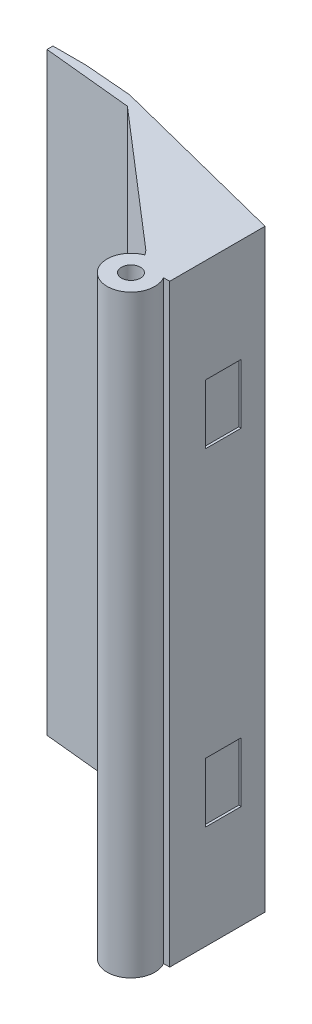
from build123d import *

# Parameters (mm, degrees)
ONE_PIECE_PROGRESSIVE_SOLID_WEDGE_DEPTH      = 99.7
ONE_PIECE_PROGRESSIVE_SOLID_WEDGE_DEPTH_BACK = 99.7
INTEGRAL_FULL_WIDTH_PIVOT_BOSS_DEPTH         = 99.7
INTEGRAL_FULL_WIDTH_PIVOT_BOSS_DEPTH_BACK    = 99.7
SKETCH_2_R                                   = 8
M6_MANUAL_PIVOT_DEPTH                        = 110
M6_MANUAL_PIVOT_DEPTH_BACK                   = 110
SKETCH_3_R                                   = 3.2
RECESSED_HOOK_PATCH_65_START                 = -45
SKETCH_4_W                                   = 0.81
SKETCH_4_H                                   = 12
RECESSED_HOOK_PATCH_65_DEPTH                 = 20
RECESSED_HOOK_PATCH_45_START                 = 65
SKETCH_5_W                                   = 0.81
SKETCH_5_H                                   = 12
RECESSED_HOOK_PATCH_45_DEPTH                 = 20


with BuildPart() as part:
    # 草图1 → One_piece_progressive_solid_wedge (new, two sides: drawn at the far end of the back side and taken through both)
    with BuildSketch(Plane(origin=(0, 0, 0), x_dir=(1, 0, 0), z_dir=(0, 1, 0)).offset(-ONE_PIECE_PROGRESSIVE_SOLID_WEDGE_DEPTH_BACK)):
        Polygon((-198, -1.2), (-198, -3.2), (-168, -6.2), (-123, -45), (-119, -50), (-110, -50), (-110, -18), (-171, -2.5), (-187, -1.2), align=None)
    extrude(amount=ONE_PIECE_PROGRESSIVE_SOLID_WEDGE_DEPTH + ONE_PIECE_PROGRESSIVE_SOLID_WEDGE_DEPTH_BACK)

    # 草图2 → Integral_full_width_pivot_boss (add, two sides: drawn at the far end of the back side and taken through both)
    with BuildSketch(Plane(origin=(0, 0, 0), x_dir=(1, 0, 0), z_dir=(0, 1, 0)).offset(-INTEGRAL_FULL_WIDTH_PIVOT_BOSS_DEPTH_BACK)):
        with Locations((-119, -54)):
            Circle(SKETCH_2_R)
    extrude(amount=INTEGRAL_FULL_WIDTH_PIVOT_BOSS_DEPTH + INTEGRAL_FULL_WIDTH_PIVOT_BOSS_DEPTH_BACK)

    # 草图3 → M6_manual_pivot (cut, two sides: drawn at the far end of the back side and taken through both)
    with BuildSketch(Plane(origin=(0, 0, 0), x_dir=(1, 0, 0), z_dir=(0, 1, 0)).offset(-M6_MANUAL_PIVOT_DEPTH_BACK)):
        with Locations((-119, -54)):
            Circle(SKETCH_3_R)
    extrude(amount=M6_MANUAL_PIVOT_DEPTH + M6_MANUAL_PIVOT_DEPTH_BACK, mode=Mode.SUBTRACT)

    # 草图4 → Recessed_hook_patch_-65 (cut)
    with BuildSketch(Plane(origin=(0, 0, 0), x_dir=(1, 0, 0), z_dir=(0, 1, 0)).offset(RECESSED_HOOK_PATCH_65_START)):
        with Locations((-110.395, -32)):
            Rectangle(SKETCH_4_W, SKETCH_4_H)
    extrude(amount=-RECESSED_HOOK_PATCH_65_DEPTH, mode=Mode.SUBTRACT)

    # 草图5 → Recessed_hook_patch_45 (cut)
    with BuildSketch(Plane(origin=(0, 0, 0), x_dir=(1, 0, 0), z_dir=(0, 1, 0)).offset(RECESSED_HOOK_PATCH_45_START)):
        with Locations((-110.395, -32)):
            Rectangle(SKETCH_5_W, SKETCH_5_H)
    extrude(amount=-RECESSED_HOOK_PATCH_45_DEPTH, mode=Mode.SUBTRACT)


solid = part.part
